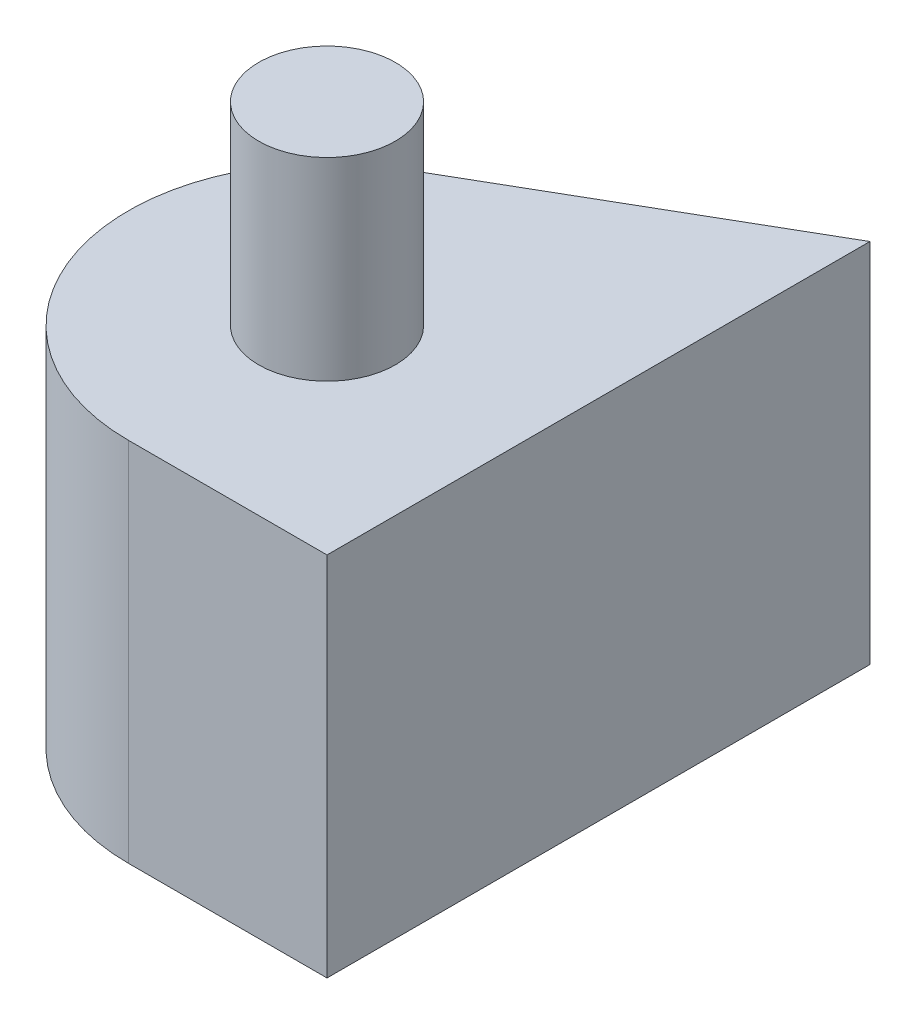
from build123d import *

# Parameters (mm, degrees)
BOSS_EXTRU_1_DEPTH = 14.75
ESQUISSE2_R        = 2.75
BOSS_EXTRU_6_DEPTH = 7.8
BOSS_EXTRU_7_START = -17.9
ESQUISSE2_4_R      = 2.75
BOSS_EXTRU_7_DEPTH = 17.9


with BuildPart() as part:
    # Esquisse1 → Boss.-Extru.1 (new body)
    with BuildSketch(Plane(origin=(0, 0, 0), x_dir=(1, 0, 0), z_dir=(0, 1, 0))):
        with BuildLine():
            Line((0, -8), (8, -8))
            Line((8, -8), (8, 13.856406461))
            Line((8, 13.856406461), (-4, 6.92820323))
            ThreePointArc((-4, 6.92820323), (-7.72740661, -2.070552361), (0, -8))
        make_face()
    extrude(amount=BOSS_EXTRU_1_DEPTH)

    # Esquisse2 → Boss.-Extru.6 (add)
    with BuildSketch(Plane(origin=(0, 14.75, 0), x_dir=(1, 0, 0), z_dir=(0, 1, 0))):
        Circle(ESQUISSE2_R)
    extrude(amount=BOSS_EXTRU_6_DEPTH)

    # Esquisse2<4> → Boss.-Extru.7 (add)
    with BuildSketch(Plane(origin=(0, 14.75, 0), x_dir=(1, 0, 0), z_dir=(0, 1, 0)).offset(BOSS_EXTRU_7_START)):
        Circle(ESQUISSE2_4_R)
    extrude(amount=BOSS_EXTRU_7_DEPTH)


solid = part.part
